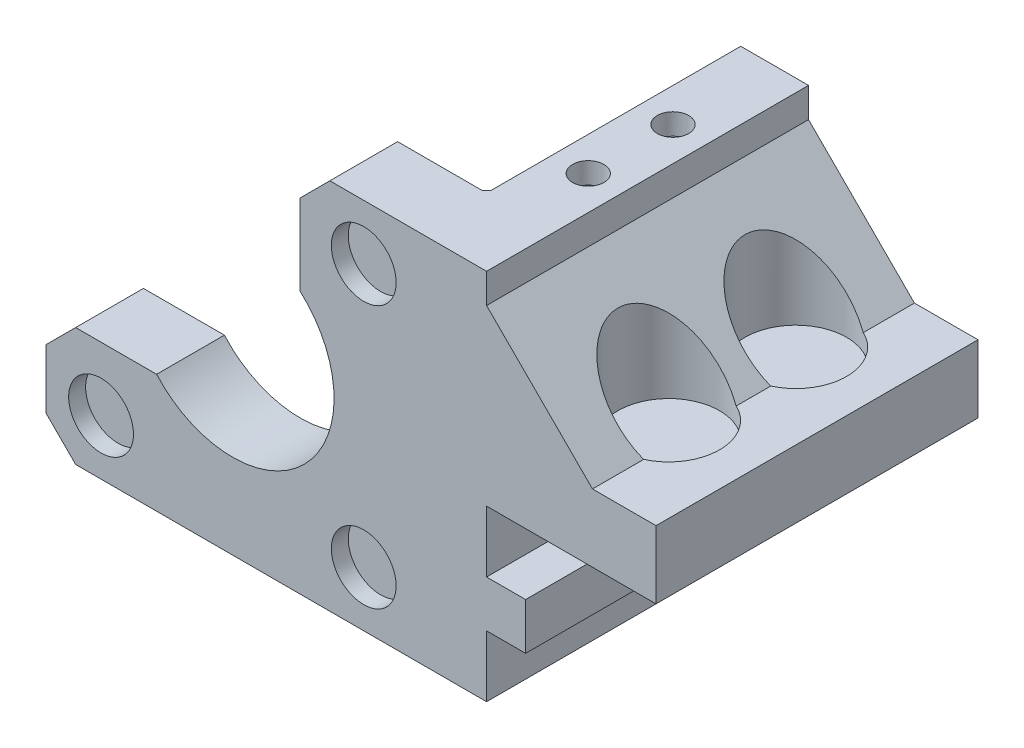
from build123d import *

# Parameters (mm, degrees)
SKETCH1_R           = 1.85
BOSS_EXTRUDE1_DEPTH = 8
BOSS_EXTRUDE3_DEPTH = 38
CHAMFER1_SIZE       = 3.5
CHAMFER2_SIZE       = 12.5
SKETCH4_R           = 2.825
CUT_EXTRUDE1_DEPTH  = 15
CUT_EXTRUDE2_START  = -2
SKETCH5_R           = 6
CUT_EXTRUDE2_DEPTH  = 15
CHAMFER3_SIZE       = 0.5
SKETCH6_R           = 3.825
CUT_EXTRUDE3_DEPTH  = 2
SKETCH10_R          = 1.85
CUT_EXTRUDE6_DEPTH  = 10
CUT_EXTRUDE7_START  = -2.5
CUT_EXTRUDE7_DEPTH  = 2.8
SKETCH12_R          = 3.940095522
SKETCH12_R_2        = 4.765678208
PRINT_HELPER_DEPTH  = 0.65
SKETCH7_R           = 2.546325066
SKETCH7_R_2         = 2.762394701
SKETCH7_R_3         = 2.98597441
PRINT_HELPER1_DEPTH = 0.65


with BuildPart() as part:
    # Sketch1 → Boss-Extrude1 (new body)
    with BuildSketch(Plane.XY):
        with BuildLine():
            ThreePointArc((-8.94427191, -8), (8.485281374, -8.485281374), (8, 8.94427191))
            Line((8, 8.94427191), (8, 22))
            Line((8, 22), (22, 22))
            Line((22, 22), (22, -22))
            Line((22, -22), (-22, -22))
            Line((-22, -22), (-22, -8))
            Line((-22, -8), (-8.94427191, -8))
        make_face()
        with Locations((-15.5, -15.5)):
            Circle(SKETCH1_R, mode=Mode.SUBTRACT)
        with Locations((15.5, -15.5)):
            Circle(SKETCH1_R, mode=Mode.SUBTRACT)
        with Locations((15.5, 15.5)):
            Circle(SKETCH1_R, mode=Mode.SUBTRACT)
    extrude(amount=BOSS_EXTRUDE1_DEPTH)

    # Sketch3 → Boss-Extrude3 (add)
    with BuildSketch(Plane.XY.offset(8)):
        Polygon((30, -9.25), (30, -2), (50, -2), (50, 6), (30, 6), (30, 22), (22, 22), (22, 6), (22, -22), (30, -22), (30, -14.75), (34.606555482, -14.75), (34.606555482, -9.25), align=None)
    extrude(amount=-BOSS_EXTRUDE3_DEPTH)

    # Chamfer1
    chamfer1_edges = [part.edges().sort_by_distance(p)[0] for p in [
        (8, 22, 4),
        (-22, -22, 4),
        (-22, -8, 4),
    ]]
    chamfer(chamfer1_edges, length=CHAMFER1_SIZE)

    # Chamfer2
    chamfer2_edges = [part.edges().sort_by_distance(p)[0] for p in [
        (30, 6, -11),
    ]]
    chamfer(chamfer2_edges, length=CHAMFER2_SIZE)

    # Sketch4 → Cut-Extrude1 (cut)
    with BuildSketch(Plane.XZ.offset(2)):
        with Locations(Location((40, -3.5, 0), (0, 0, 270))):
            Circle(SKETCH4_R)
        with Locations(Location((40, -18.5, 0), (0, 0, 270))):
            Circle(SKETCH4_R)
    extrude(amount=-CUT_EXTRUDE1_DEPTH, mode=Mode.SUBTRACT)

    # Sketch5 → Cut-Extrude2 (cut)
    with BuildSketch(Plane(origin=(0, 6, 0), x_dir=(1, 0, 0), z_dir=(0, 1, 0)).offset(CUT_EXTRUDE2_START)):
        with Locations(Location((40, 18.5, 0), (0, 0, 65.375681648))):
            Circle(SKETCH5_R)
        with Locations(Location((40, 3.5, 0), (0, 0, 65.375681648))):
            Circle(SKETCH5_R)
    extrude(amount=CUT_EXTRUDE2_DEPTH, mode=Mode.SUBTRACT)

    # Chamfer3
    chamfer3_edges = [part.edges().sort_by_distance(p)[0] for p in [
        (22, 0, 0),
    ]]
    chamfer(chamfer3_edges, length=CHAMFER3_SIZE)

    # Sketch6 → Cut-Extrude3 (cut)
    with BuildSketch(Plane.XY.offset(8)):
        with Locations((15.5, 15.5)):
            Circle(SKETCH6_R)
        with Locations((15.5, -15.5)):
            Circle(SKETCH6_R)
        with Locations((-15.5, -15.5)):
            Circle(SKETCH6_R)
    extrude(amount=-CUT_EXTRUDE3_DEPTH, mode=Mode.SUBTRACT)

    # Sketch10 → Cut-Extrude6 (cut)
    with BuildSketch(Plane(origin=(0, 22, 0), x_dir=(1, 0, 0), z_dir=(0, 1, 0))):
        with Locations(Location((26, 8, 0), (0, 0, 180))):
            Circle(SKETCH10_R)
        with Locations(Location((26, 18, 0), (0, 0, 180))):
            Circle(SKETCH10_R)
    extrude(amount=-CUT_EXTRUDE6_DEPTH, mode=Mode.SUBTRACT)

    # Sketch11 → Cut-Extrude7 (cut)
    with BuildSketch(Plane(origin=(0, 22, 0), x_dir=(1, 0, 0), z_dir=(0, 1, 0)).offset(CUT_EXTRUDE7_START)):
        Polygon((24.239081679, 14.95), (27.760918321, 14.95), (29.521836642, 18), (27.760918321, 21.05), (24.239081679, 21.05), (20.488418147, 21.05), (20.488418147, 14.95), align=None)
        Polygon((24.239081679, 4.95), (27.760918321, 4.95), (29.521836642, 8), (27.760918321, 11.05), (24.239081679, 11.05), (20.488418147, 11.05), (20.488418147, 4.95), align=None)
    extrude(amount=-CUT_EXTRUDE7_DEPTH, mode=Mode.SUBTRACT)

    # Sketch12 → print_helper (add)
    with BuildSketch(Plane(origin=(0, 4, 0), x_dir=(1, 0, 0), z_dir=(0, 1, 0))):
        with Locations((40, 3.5)):
            Circle(SKETCH12_R)
        with Locations((40, 18.5)):
            Circle(SKETCH12_R_2)
    extrude(amount=-PRINT_HELPER_DEPTH)

    # Sketch7 → print_helper1 (add)
    with BuildSketch(Plane.XY.offset(6)):
        with Locations((15.5, 15.5)):
            Circle(SKETCH7_R)
        with Locations((15.5, -15.5)):
            Circle(SKETCH7_R_2)
        with Locations((-15.5, -15.5)):
            Circle(SKETCH7_R_3)
    extrude(amount=-PRINT_HELPER1_DEPTH)


solid = part.part
